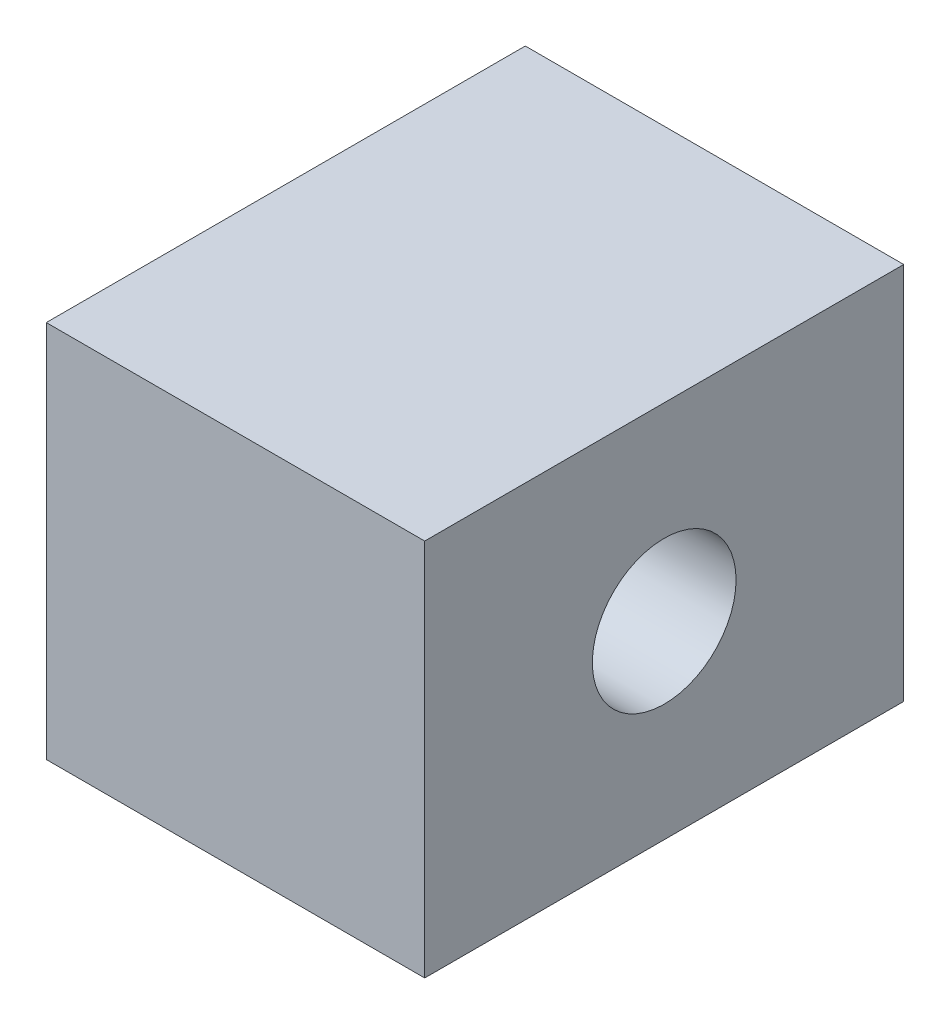
from build123d import *

# Parameters (mm, degrees)
SZKIC1_W                    = 15.8
SZKIC1_H                    = 15.8
DODANIE_WYCI_GNI_CIE1_DEPTH = 20
SZKIC2_R                    = 3
WYTNIJ_WYCI_GNI_CIE1_DEPTH  = 20


with BuildPart() as part:
    # Szkic1 → Dodanie-wyciągnięcie1 (new body)
    with BuildSketch(Plane.XY):
        with Locations((7.9, 7.9)):
            Rectangle(SZKIC1_W, SZKIC1_H)
    extrude(amount=DODANIE_WYCI_GNI_CIE1_DEPTH)

    # Szkic2 → Wytnij-wyciągnięcie1 (cut)
    with BuildSketch(Plane(origin=(15.8, 0, 0), x_dir=(0, 0, -1), z_dir=(1, 0, 0))):
        with Locations((-10, 7.9)):
            Circle(SZKIC2_R)
    extrude(amount=-WYTNIJ_WYCI_GNI_CIE1_DEPTH, mode=Mode.SUBTRACT)


solid = part.part
